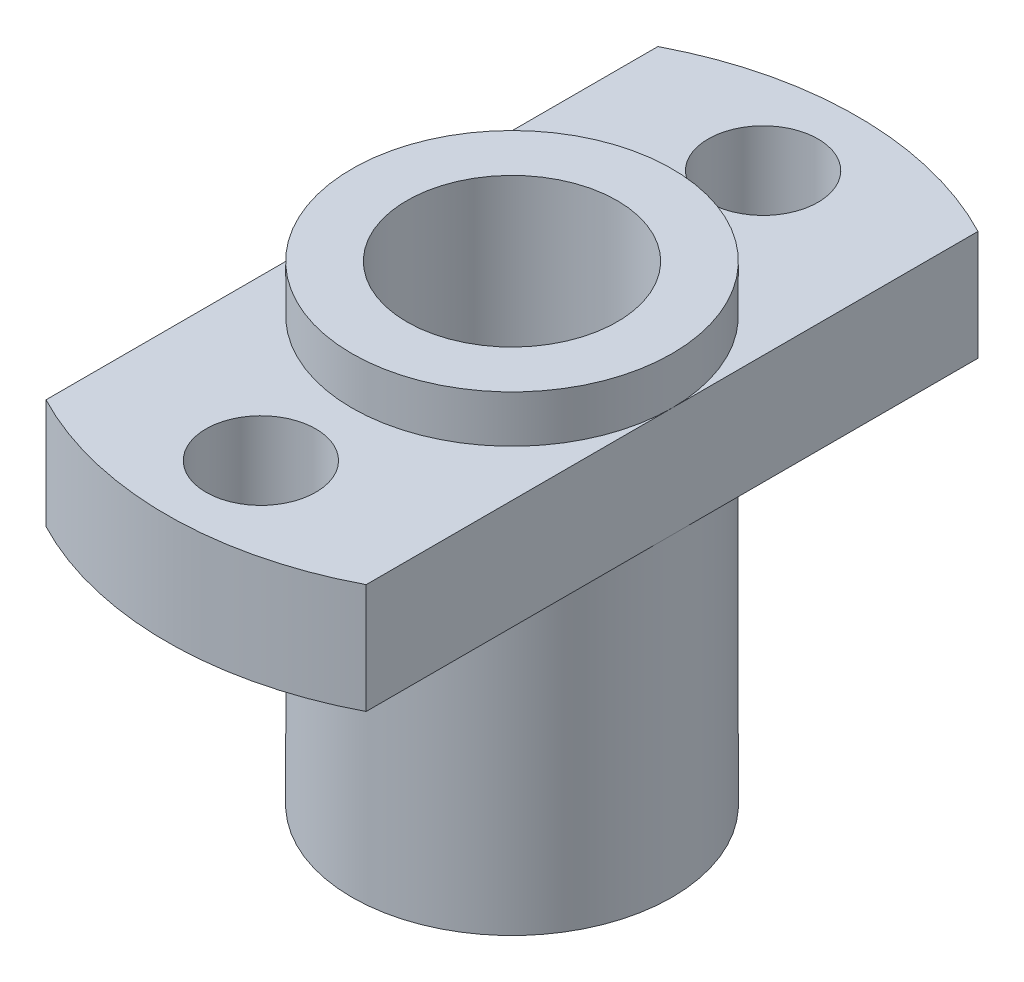
from build123d import *

# Parameters (mm, degrees)
SKETCH1_R           = 5.1
BOSS_EXTRUDE1_DEPTH = 15
SKETCH2_R           = 1.75
BOSS_EXTRUDE2_DEPTH = 3.5
SKETCH3_R           = 3.35
CUT_EXTRUDE1_DEPTH  = 20.287560758


with BuildPart() as part:
    # Sketch1 → Boss-Extrude1 (new body)
    with BuildSketch(Plane(origin=(0, 0, 0), x_dir=(1, 0, 0), z_dir=(0, 1, 0))):
        with Locations(Location((0, 0, 0), (0, 0, 270))):
            Circle(SKETCH1_R)
    extrude(amount=BOSS_EXTRUDE1_DEPTH)

    # Sketch2 → Boss-Extrude2 (add)
    with BuildSketch(Plane(origin=(0, 13.5, 0), x_dir=(1, 0, 0), z_dir=(0, 1, 0))):
        with BuildLine():
            Line((-5.1, 9.746281342), (-5.1, -9.746281342))
            ThreePointArc((-5.1, -9.746281342), (0, -11), (5.1, -9.746281342))
            Line((5.1, -9.746281342), (5.1, 9.746281342))
            ThreePointArc((5.1, 9.746281342), (0, 11), (-5.1, 9.746281342))
        make_face()
        with Locations(Location((0, 8, 0), (0, 0, 270))):
            Circle(SKETCH2_R, mode=Mode.SUBTRACT)
        with Locations(Location((0, -8, 0), (0, 0, 270))):
            Circle(SKETCH2_R, mode=Mode.SUBTRACT)
    extrude(amount=-BOSS_EXTRUDE2_DEPTH)

    # Sketch3 → Cut-Extrude1 (cut, through all)
    with BuildSketch(Plane(origin=(0, 15, 0), x_dir=(1, 0, 0), z_dir=(0, 1, 0))):
        with Locations(Location((0, 0, 0), (0, 0, 270))):
            Circle(SKETCH3_R)
    extrude(amount=-CUT_EXTRUDE1_DEPTH, mode=Mode.SUBTRACT)


solid = part.part
